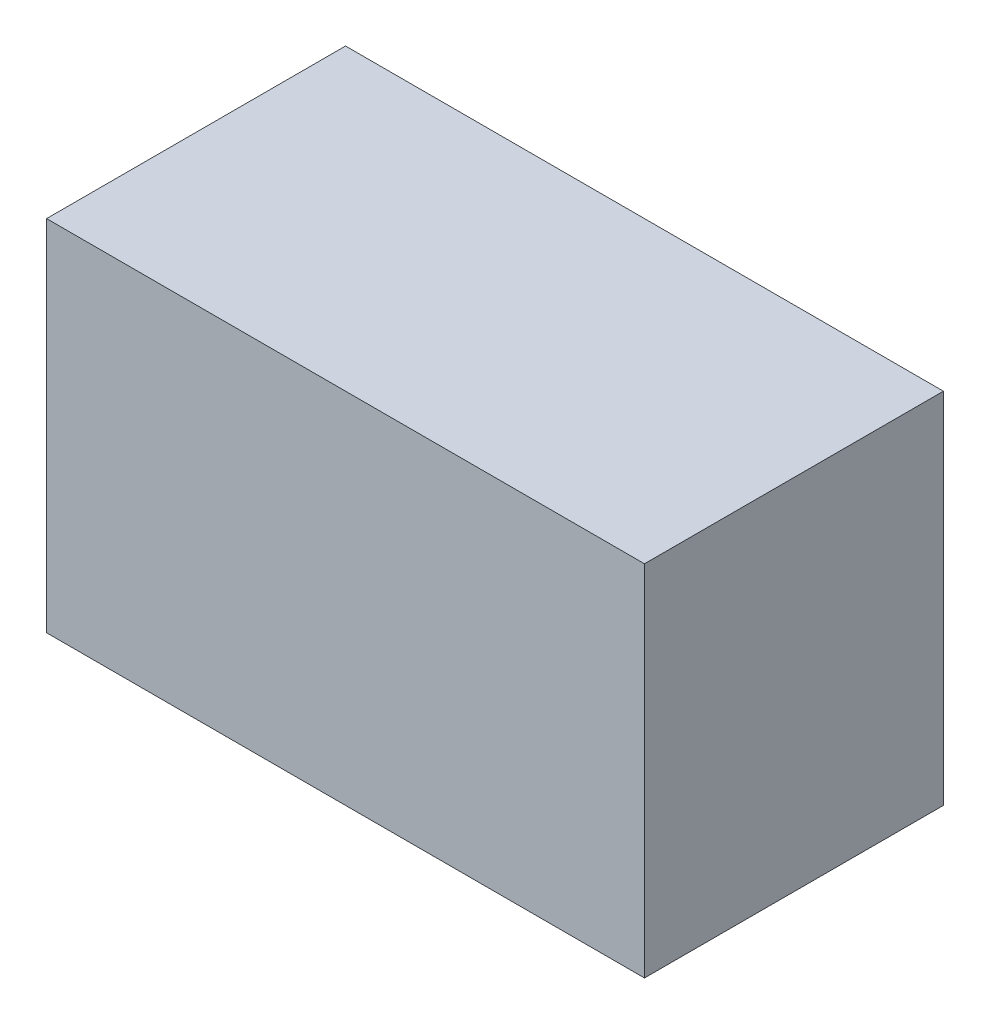
from build123d import *

# Parameters (mm, degrees)
SKETCH1_W           = 30
SKETCH1_H           = 30
BOSS_EXTRUDE1_DEPTH = 18
SKETCH2_W           = 15
SKETCH2_H           = 15
CUT_EXTRUDE1_DEPTH  = 28.820855486
SKETCH3_W           = 15
SKETCH3_H           = 15
CUT_EXTRUDE2_DEPTH  = 28.820855486


with BuildPart() as part:
    # Sketch1 → Boss-Extrude1 (new body)
    with BuildSketch(Plane(origin=(0, 0, 0), x_dir=(1, 0, 0), z_dir=(0, 1, 0))):
        Rectangle(SKETCH1_W, SKETCH1_H)
    extrude(amount=BOSS_EXTRUDE1_DEPTH)

    # Sketch2 → Cut-Extrude1 (cut, through all)
    with BuildSketch(Plane(origin=(0, 18, 0), x_dir=(1, 0, 0), z_dir=(0, 1, 0))):
        with Locations((7.5, -7.5)):
            Rectangle(SKETCH2_W, SKETCH2_H)
    extrude(amount=-CUT_EXTRUDE1_DEPTH, mode=Mode.SUBTRACT)

    # Sketch3 → Cut-Extrude2 (cut, through all)
    with BuildSketch(Plane(origin=(0, 18, 0), x_dir=(1, 0, 0), z_dir=(0, 1, 0))):
        with Locations((-7.5, -7.5)):
            Rectangle(SKETCH3_W, SKETCH3_H)
    extrude(amount=-CUT_EXTRUDE2_DEPTH, mode=Mode.SUBTRACT)


solid = part.part
